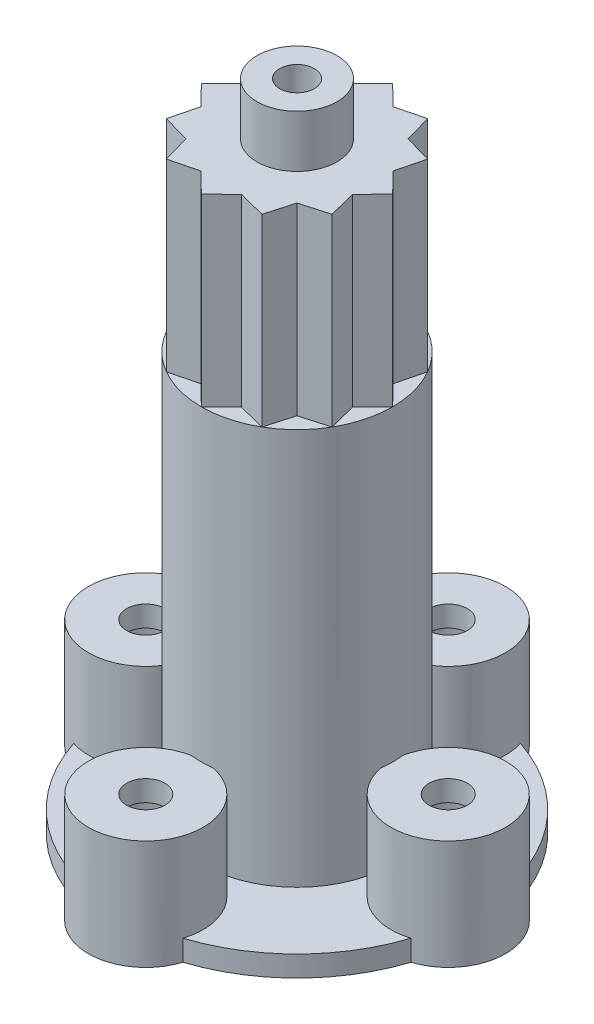
from build123d import *

# Parameters (mm, degrees)
SKETCH1_R            = 10.2
BOSS_EXTRUDE1_DEPTH  = 1.2
SKETCH3_R            = 5.5
BOSS_EXTRUDE2_DEPTH  = 22.8
SKETCH6_R            = 3.3
BOSS_EXTRUDE7_DEPTH  = 6.3
SKETCH7_R            = 2.2
CUT_EXTRUDE1_DEPTH   = 5.1
SKETCH8_R            = 1.1
CUT_EXTRUDE2_DEPTH   = 1.2
CIRPATTERN1_COUNT    = 4
SKETCH9_R            = 4.4
CUT_EXTRUDE3_DEPTH   = 22.8
SKETCH10_R           = 4.5
BOSS_EXTRUDE8_DEPTH  = 10.6
BOSS_EXTRUDE9_DEPTH  = 10.6
CIRPATTERN2_COUNT    = 12
SKETCH12_R           = 3.2
CUT_EXTRUDE4_DEPTH   = 10.6
SKETCH13_R           = 2.3
BOSS_EXTRUDE10_DEPTH = 3
SKETCH14_R           = 1
CUT_EXTRUDE5_DEPTH   = 3
BOSS_EXTRUDE11_DEPTH = 0.1


with BuildPart() as part:
    # Sketch1 → Boss-Extrude1 (new body)
    with BuildSketch(Plane(origin=(0, 0, 0), x_dir=(1, 0, 0), z_dir=(0, 1, 0))):
        Circle(SKETCH1_R)
    extrude(amount=BOSS_EXTRUDE1_DEPTH)

    # Sketch3 → Boss-Extrude2 (add)
    with BuildSketch(Plane(origin=(0, 1.2, 0), x_dir=(1, 0, 0), z_dir=(0, 1, 0))):
        Circle(SKETCH3_R)
    extrude(amount=BOSS_EXTRUDE2_DEPTH)

    # Sketch6 → Boss-Extrude7 (add)
    with BuildSketch(Plane.XZ):
        with Locations((8.7, 0)):
            Circle(SKETCH6_R)
    boss_extrude7 = extrude(amount=-BOSS_EXTRUDE7_DEPTH)

    # Sketch7 → Cut-Extrude1 (cut)
    with BuildSketch(Plane.XZ):
        with Locations((8.7, 0)):
            Circle(SKETCH7_R)
    cut_extrude1 = extrude(amount=-CUT_EXTRUDE1_DEPTH, mode=Mode.SUBTRACT)

    # Sketch8 → Cut-Extrude2 (cut)
    with BuildSketch(Plane(origin=(0, 6.3, 0), x_dir=(1, 0, 0), z_dir=(0, 1, 0))):
        with Locations((8.7, 0)):
            Circle(SKETCH8_R)
    cut_extrude2 = extrude(amount=-CUT_EXTRUDE2_DEPTH, mode=Mode.SUBTRACT)

    # CirPattern1: Boss-Extrude7, Cut-Extrude1, Cut-Extrude2 ×4 about axis
    cirpattern1_axis = Axis((0, 25.2, 0), (0, -1, 0))
    add([boss_extrude7.rotate(cirpattern1_axis, i * 360 / CIRPATTERN1_COUNT) for i in range(1, CIRPATTERN1_COUNT)])
    add([cut_extrude1.rotate(cirpattern1_axis, i * 360 / CIRPATTERN1_COUNT) for i in range(1, CIRPATTERN1_COUNT)], mode=Mode.SUBTRACT)
    add([cut_extrude2.rotate(cirpattern1_axis, i * 360 / CIRPATTERN1_COUNT) for i in range(1, CIRPATTERN1_COUNT)], mode=Mode.SUBTRACT)

    # Sketch9 → Cut-Extrude3 (cut)
    with BuildSketch(Plane(origin=(0, 0, 0), x_dir=(-1, 0, 0), z_dir=(0, -1, 0))):
        Circle(SKETCH9_R)
    extrude(amount=-CUT_EXTRUDE3_DEPTH, mode=Mode.SUBTRACT)

    # Sketch10 → Boss-Extrude8 (add)
    with BuildSketch(Plane(origin=(0, 24, 0), x_dir=(1, 0, 0), z_dir=(0, 1, 0))):
        Circle(SKETCH10_R)
    extrude(amount=BOSS_EXTRUDE8_DEPTH)

    # Sketch11 → Boss-Extrude9 (add)
    with BuildSketch(Plane(origin=(0, 24, 0), x_dir=(1, 0, 0), z_dir=(0, 1, 0))):
        Polygon((-1.2, 4.337049688), (1.2, 4.337049688), (0, 5.5), align=None)
    boss_extrude9 = extrude(amount=BOSS_EXTRUDE9_DEPTH)

    # CirPattern2: Boss-Extrude9 ×12 about axis
    cirpattern2_axis = Axis((0, 25.2, 0), (0, -1, 0))
    for i in range(1, CIRPATTERN2_COUNT):
        add(boss_extrude9.rotate(cirpattern2_axis, i * 360 / CIRPATTERN2_COUNT))

    # Sketch12 → Cut-Extrude4 (cut)
    with BuildSketch(Plane.XZ.offset(-22.8)):
        Circle(SKETCH12_R)
    extrude(amount=-CUT_EXTRUDE4_DEPTH, mode=Mode.SUBTRACT)

    # Sketch13 → Boss-Extrude10 (add)
    with BuildSketch(Plane(origin=(0, 34.6, 0), x_dir=(1, 0, 0), z_dir=(0, 1, 0))):
        Circle(SKETCH13_R)
    extrude(amount=BOSS_EXTRUDE10_DEPTH)

    # Sketch14 → Cut-Extrude5 (cut)
    with BuildSketch(Plane(origin=(0, 37.6, 0), x_dir=(1, 0, 0), z_dir=(0, 1, 0))):
        Circle(SKETCH14_R)
    extrude(amount=-CUT_EXTRUDE5_DEPTH, mode=Mode.SUBTRACT)

    # Sketch15 → Boss-Extrude11 (add)
    with BuildSketch(Plane(origin=(0, 1.2, 0), x_dir=(1, 0, 0), z_dir=(0, 1, 0))):
        Polygon((-5.03433242, -3.66566758), (-3.596315227, -5.103684773), (-3.748047753, -5.2554173), (-5.186064947, -3.817400106), align=None)
    extrude(amount=BOSS_EXTRUDE11_DEPTH)


solid = part.part
